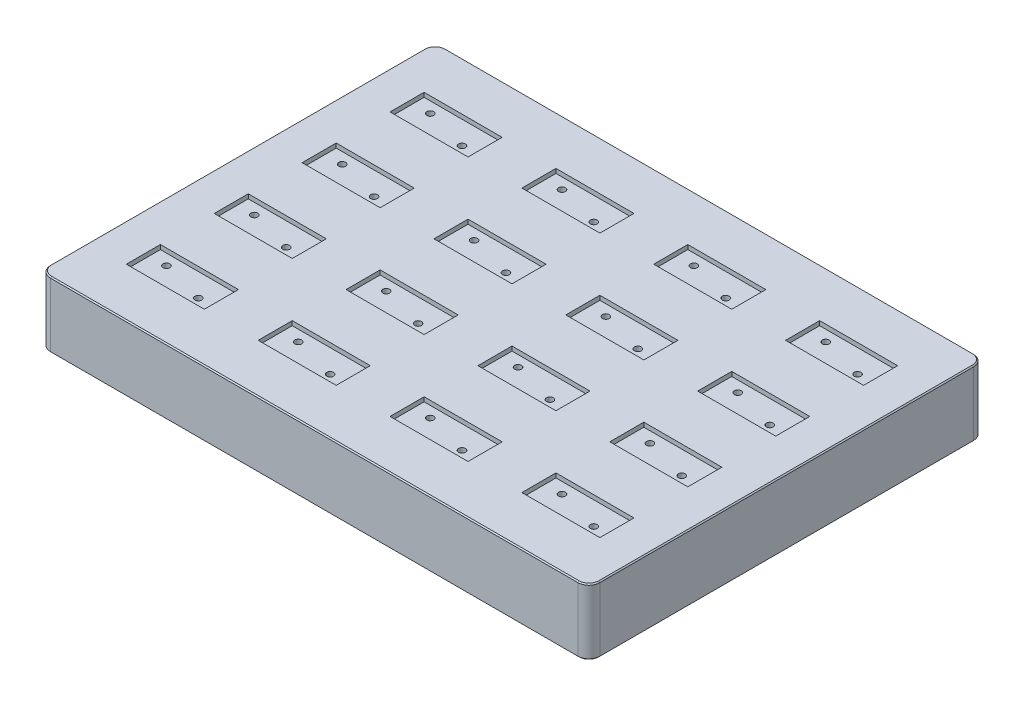
from build123d import *

# Parameters (mm, degrees)
SKETCH1_W            = 250
SKETCH1_H            = 180
BOSS_EXTRUDE1_DEPTH  = 30
SKETCH2_W            = 35.5
SKETCH2_H            = 15.5
CUT_EXTRUDE1_DEPTH   = 2
LPATTERN1_COUNT      = 4
LPATTERN1_PITCH      = 40
LPATTERN1_COUNT_DIR2 = 4
LPATTERN1_PITCH_DIR2 = 60
SKETCH3_R            = 1.55
CUT_EXTRUDE2_DEPTH   = 310.328304557
LPATTERN2_COUNT      = 4
LPATTERN2_PITCH      = 40
LPATTERN2_COUNT_DIR2 = 4
LPATTERN2_PITCH_DIR2 = 60
SKETCH4_W            = 244
SKETCH4_H            = 174
CUT_EXTRUDE3_DEPTH   = 23
FILLET1_R            = 5
CHAMFER1_SIZE        = 0.5
SKETCH5_W            = 12.5
SKETCH5_H            = 11.5
CUT_EXTRUDE4_DEPTH   = 3
FILLET2_R            = 4
SKETCH7_R            = 3
BOSS_EXTRUDE2_DEPTH  = 5
FILLET3_R            = 2
SKETCH8_R            = 1.3
CUT_EXTRUDE5_DEPTH   = 6
SKETCH9_R            = 1.6
CUT_EXTRUDE6_DEPTH   = 3
SKETCH11_R           = 5
BOSS_EXTRUDE3_DEPTH  = 21
SKETCH12_R           = 1.25
CUT_EXTRUDE7_DEPTH   = 10
FILLET4_R            = 1
SKETCH13_W           = 12.5
SKETCH13_H           = 11.5
BOSS_EXTRUDE4_DEPTH  = 1


with BuildPart() as part:
    # Sketch1 → Boss-Extrude1 (new body)
    with BuildSketch(Plane(origin=(0, 0, 0), x_dir=(1, 0, 0), z_dir=(0, 1, 0))):
        with Locations((125, 90)):
            Rectangle(SKETCH1_W, SKETCH1_H)
    extrude(amount=BOSS_EXTRUDE1_DEPTH)

    # Sketch2 → Cut-Extrude1 (cut)
    with BuildSketch(Plane(origin=(0, 30, 0), x_dir=(1, 0, 0), z_dir=(0, 1, 0))):
        with Locations((35, 30)):
            Rectangle(SKETCH2_W, SKETCH2_H)
    cut_extrude1 = extrude(amount=-CUT_EXTRUDE1_DEPTH, mode=Mode.SUBTRACT)

    # LPattern1: Cut-Extrude1 4 × 4
    with Locations(*[(j * LPATTERN1_PITCH_DIR2, 0, -i * LPATTERN1_PITCH) for i in range(LPATTERN1_COUNT) for j in range(LPATTERN1_COUNT_DIR2) if (i, j) != (0, 0)]):
        add(cut_extrude1, mode=Mode.SUBTRACT)

    # Sketch3 → Cut-Extrude2 (cut, through all)
    with BuildSketch(Plane(origin=(0, 28, 0), x_dir=(1, 0, 0), z_dir=(0, 1, 0))):
        with Locations(Location((25, 32.75, 0), (0, 0, 270))):
            Circle(SKETCH3_R)
        with Locations(Location((45, 27.25, 0), (0, 0, 270))):
            Circle(SKETCH3_R)
    cut_extrude2 = extrude(amount=-CUT_EXTRUDE2_DEPTH, mode=Mode.SUBTRACT)

    # LPattern2: Cut-Extrude2 4 × 4
    with Locations(*[(j * LPATTERN2_PITCH_DIR2, 0, -i * LPATTERN2_PITCH) for i in range(LPATTERN2_COUNT) for j in range(LPATTERN2_COUNT_DIR2) if (i, j) != (0, 0)]):
        add(cut_extrude2, mode=Mode.SUBTRACT)

    # Sketch4 → Cut-Extrude3 (cut)
    with BuildSketch(Plane.XZ):
        with Locations((125, -90)):
            Rectangle(SKETCH4_W, SKETCH4_H)
    extrude(amount=-CUT_EXTRUDE3_DEPTH, mode=Mode.SUBTRACT)

    # Fillet1
    fillet1_edges = [part.edges().sort_by_distance(p)[0] for p in [
        (0, 15, -180),
        (250, 15, -180),
        (250, 15, 0),
        (0, 15, 0),
    ]]
    fillet(fillet1_edges, radius=FILLET1_R)

    # Chamfer1
    chamfer1_edges = [part.edges().sort_by_distance(p)[0] for p in [
        (0, 0, -90),
        (0, 30, -90),
        (125, 0, -180),
        (250, 0, -90),
        (125, 0, 0),
        (248.535533906, 0, -178.535533906),
        (248.535533906, 0, -1.464466094),
        (1.464466094, 0, -1.464466094),
        (1.464466094, 0, -178.535533906),
        (125, 30, -180),
        (125, 30, 0),
        (250, 30, -90),
        (248.535533906, 30, -178.535533906),
        (248.535533906, 30, -1.464466094),
        (1.464466094, 30, -1.464466094),
        (1.464466094, 30, -178.535533906),
    ]]
    chamfer(chamfer1_edges, length=CHAMFER1_SIZE)

    # Sketch5 → Cut-Extrude4 (cut)
    with BuildSketch(Plane(origin=(0, 0, -180), x_dir=(-1, 0, 0), z_dir=(0, 0, -1))):
        with Locations((-30.55, 10.75)):
            Rectangle(SKETCH5_W, SKETCH5_H)
    extrude(amount=-CUT_EXTRUDE4_DEPTH, mode=Mode.SUBTRACT)

    # Fillet2
    fillet2_edges = [part.edges().sort_by_distance(p)[0] for p in [
        (3, 11.5, -177),
        (3, 11.5, -3),
        (247, 11.5, -3),
        (247, 11.5, -177),
    ]]
    fillet(fillet2_edges, radius=FILLET2_R)

    # Sketch7 → Boss-Extrude2 (add)
    with BuildSketch(Plane.XZ.offset(-23)):
        with Locations(Location((17.78, -83.48, 0), (0, 0, 270))):
            Circle(SKETCH7_R)
        with Locations(Location((66.04, -77.13, 0), (0, 0, 270))):
            Circle(SKETCH7_R)
        with Locations(Location((60.96, -107.61, 0), (0, 0, 270))):
            Circle(SKETCH7_R)
        with Locations(Location((33.02, -107.61, 0), (0, 0, 270))):
            Circle(SKETCH7_R)
        with Locations(Location((17.78, -158.41, 0), (0, 0, 270))):
            Circle(SKETCH7_R)
        with Locations(Location((66.04, -159.68, 0), (0, 0, 270))):
            Circle(SKETCH7_R)
    extrude(amount=BOSS_EXTRUDE2_DEPTH)

    # Fillet3
    fillet3_edges = [part.edges().sort_by_distance(p)[0] for p in [
        (17.78, 23, -80.48),
        (66.04, 23, -74.13),
        (60.96, 23, -104.61),
        (33.02, 23, -104.61),
        (17.78, 23, -155.41),
        (66.04, 23, -156.68),
    ]]
    fillet(fillet3_edges, radius=FILLET3_R)

    # Sketch8 → Cut-Extrude5 (cut)
    with BuildSketch(Plane.XZ.offset(-18)):
        with Locations(Location((17.78, -83.48, 0), (0, 0, 270))):
            Circle(SKETCH8_R)
        with Locations(Location((66.04, -77.13, 0), (0, 0, 270))):
            Circle(SKETCH8_R)
        with Locations(Location((60.96, -107.61, 0), (0, 0, 270))):
            Circle(SKETCH8_R)
        with Locations(Location((33.02, -107.61, 0), (0, 0, 270))):
            Circle(SKETCH8_R)
        with Locations(Location((17.78, -158.41, 0), (0, 0, 270))):
            Circle(SKETCH8_R)
        with Locations(Location((66.04, -159.68, 0), (0, 0, 270))):
            Circle(SKETCH8_R)
    extrude(amount=-CUT_EXTRUDE5_DEPTH, mode=Mode.SUBTRACT)

    # Sketch9 → Cut-Extrude6 (cut)
    with BuildSketch(Plane.XY.offset(-177)):
        with Locations((222.1, 11.265)):
            Circle(SKETCH9_R)
        with Locations((175.1, 11.265)):
            Circle(SKETCH9_R)
        with BuildLine():
            Line((216.3, 17.35), (180.9, 17.35))
            ThreePointArc((180.9, 17.35), (179.138097781, 16.528411502), (178.634942168, 14.650609191))
            Line((178.634942168, 14.650609191), (179.969737412, 7.080609191))
            ThreePointArc((179.969737412, 7.080609191), (180.756383742, 5.718097781), (182.234795244, 5.18))
            Line((182.234795244, 5.18), (214.965204756, 5.18))
            ThreePointArc((214.965204756, 5.18), (216.443616258, 5.718097781), (217.230262588, 7.080609191))
            Line((217.230262588, 7.080609191), (218.565057832, 14.650609191))
            ThreePointArc((218.565057832, 14.650609191), (218.061902219, 16.528411502), (216.3, 17.35))
        make_face()
    extrude(amount=-CUT_EXTRUDE6_DEPTH, mode=Mode.SUBTRACT)

    # Sketch11 → Boss-Extrude3 (add)
    with BuildSketch(Plane.XZ.offset(-23)):
        with Locations((7.5, -7.5)):
            Circle(SKETCH11_R)
        with Locations((242.5, -7.5)):
            Circle(SKETCH11_R)
        with Locations((242.5, -172.5)):
            Circle(SKETCH11_R)
        with Locations((7.5, -172.5)):
            Circle(SKETCH11_R)
        with Locations((125, -7.5)):
            Circle(SKETCH11_R)
        with Locations((242.5, -90)):
            Circle(SKETCH11_R)
        with Locations((7.5, -90)):
            Circle(SKETCH11_R)
        with Locations((125, -172.5)):
            Circle(SKETCH11_R)
    extrude(amount=BOSS_EXTRUDE3_DEPTH)

    # Sketch12 → Cut-Extrude7 (cut)
    with BuildSketch(Plane.XZ.offset(-2)):
        with Locations(Location((7.5, -90, 0), (0, 0, 270))):
            Circle(SKETCH12_R)
        with Locations(Location((7.5, -7.5, 0), (0, 0, 270))):
            Circle(SKETCH12_R)
        with Locations(Location((125, -7.5, 0), (0, 0, 270))):
            Circle(SKETCH12_R)
        with Locations(Location((242.5, -7.5, 0), (0, 0, 270))):
            Circle(SKETCH12_R)
        with Locations(Location((242.5, -90, 0), (0, 0, 270))):
            Circle(SKETCH12_R)
        with Locations(Location((242.5, -172.5, 0), (0, 0, 270))):
            Circle(SKETCH12_R)
        with Locations(Location((125, -172.5, 0), (0, 0, 270))):
            Circle(SKETCH12_R)
        with Locations(Location((7.5, -172.5, 0), (0, 0, 270))):
            Circle(SKETCH12_R)
    extrude(amount=-CUT_EXTRUDE7_DEPTH, mode=Mode.SUBTRACT)

    # Fillet4
    fillet4_edges = [part.edges().sort_by_distance(p)[0] for p in [
        (9.679449472, 12.5, -3),
        (3, 12.5, -9.679449472),
        (247, 12.5, -9.679449472),
        (240.320550528, 12.5, -3),
        (240.320550528, 12.5, -177),
        (247, 12.5, -170.320550528),
        (3, 12.5, -170.320550528),
        (9.679449472, 12.5, -177),
        (122.820550528, 12.5, -3),
        (127.179449472, 12.5, -3),
        (247, 12.5, -87.820550528),
        (247, 12.5, -92.179449472),
        (3, 12.5, -92.179449472),
        (3, 12.5, -87.820550528),
        (127.179449472, 12.5, -177),
        (122.820550528, 12.5, -177),
    ]]
    fillet(fillet4_edges, radius=FILLET4_R)


with BuildPart() as body_2:
    # Sketch13 → Boss-Extrude4 (new body)
    with BuildSketch(Plane(origin=(0, 0, -180), x_dir=(-1, 0, 0), z_dir=(0, 0, -1))):
        with Locations((-30.55, 10.75)):
            Rectangle(SKETCH13_W, SKETCH13_H)
    extrude(amount=-BOSS_EXTRUDE4_DEPTH)


solid = Compound([part.part, body_2.part])
